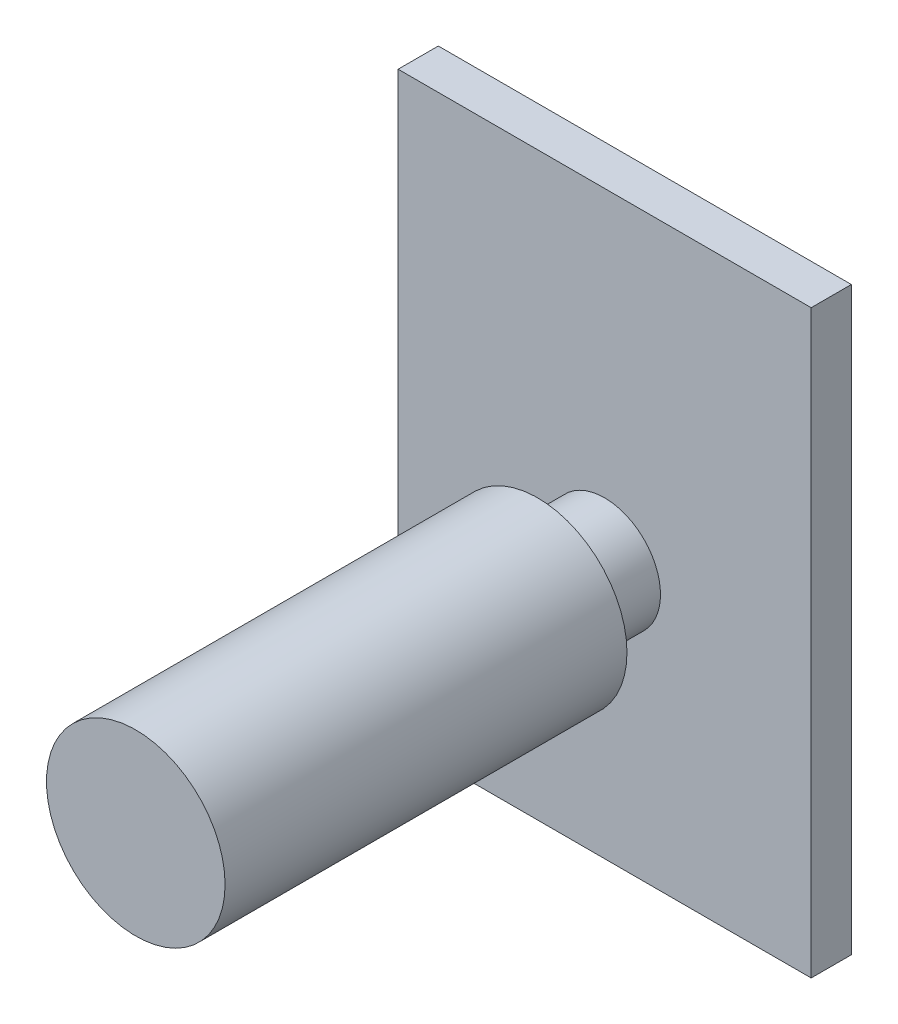
from build123d import *

# Parameters (mm, degrees)
SKETCH1_W           = 18.5
SKETCH1_H           = 26
BOSS_EXTRUDE1_DEPTH = 1.8
SKETCH2_R           = 2.5
BOSS_EXTRUDE2_DEPTH = 3
SKETCH3_R           = 4
BOSS_EXTRUDE3_DEPTH = 18


with BuildPart() as part:
    # Sketch1 → Boss-Extrude1 (new body)
    with BuildSketch(Plane.XY):
        with Locations((0, 1.5)):
            Rectangle(SKETCH1_W, SKETCH1_H)
    extrude(amount=BOSS_EXTRUDE1_DEPTH)

    # Sketch2 → Boss-Extrude2 (add)
    with BuildSketch(Plane.XY.offset(1.8)):
        Circle(SKETCH2_R)
    extrude(amount=BOSS_EXTRUDE2_DEPTH)

    # Sketch3 → Boss-Extrude3 (add)
    with BuildSketch(Plane.XY.offset(4.8)):
        Circle(SKETCH3_R)
    extrude(amount=BOSS_EXTRUDE3_DEPTH)


solid = part.part
